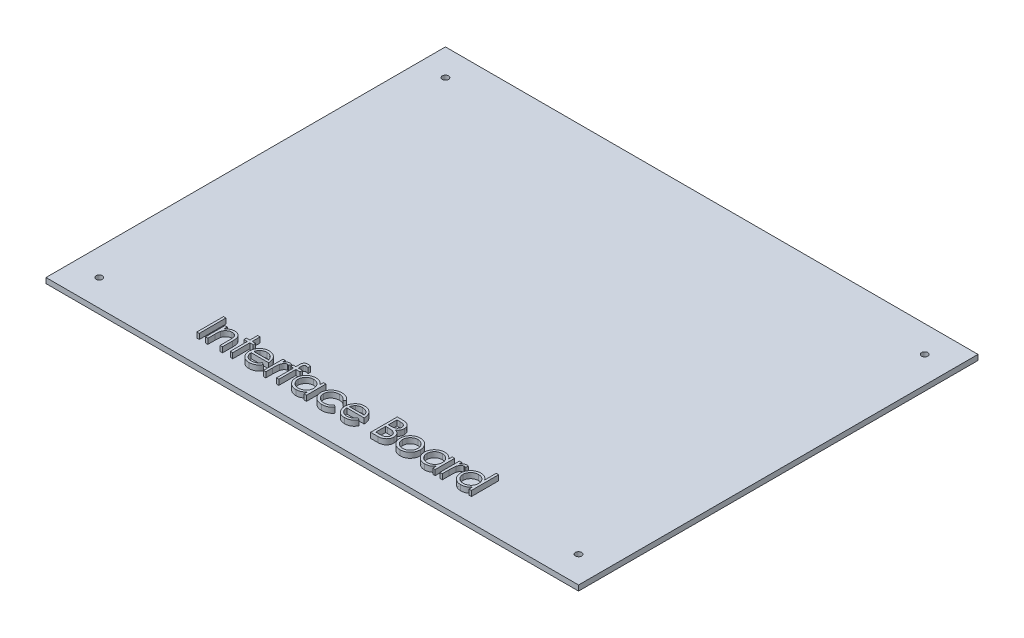
from build123d import *

# Parameters (mm, degrees)
SKETCH1_W             = 254
SKETCH1_H             = 190.5
BOSS_EXTRUDE1_DEPTH   = 2.54
F_3_0MM_DOWEL_HOLE1_D = 3
SKETCH5_W             = 1.13974359
SKETCH5_H             = 12.7
BOSS_EXTRUDE2_DEPTH   = 2.54


with BuildPart() as part:
    # Sketch1 → Boss-Extrude1 (new body)
    with BuildSketch(Plane(origin=(0, 0, 0), x_dir=(1, 0, 0), z_dir=(0, 1, 0))):
        Rectangle(SKETCH1_W, SKETCH1_H)
    extrude(amount=BOSS_EXTRUDE1_DEPTH)

    # Ø3.0mm Dowel Hole1 (through all)
    with Locations(Plane(origin=(0, 2.54, 0), x_dir=(1, 0, 0), z_dir=(0, 1, 0))):
        with Locations((-114.3, 82.55), (114.3, 82.55), (114.3, -82.55), (-114.3, -82.55)):
            Hole(F_3_0MM_DOWEL_HOLE1_D / 2)

    # Sketch5 → Boss-Extrude2 (add)
    # profile 1 of 14: a face of its own
    with BuildSketch(Plane(origin=(0, 2.54, 0), x_dir=(1, 0, 0), z_dir=(0, 1, 0))):
        with Locations((-65.411388588, -77.958886112)):
            Rectangle(SKETCH5_W, SKETCH5_H)
    # profile 2 of 14: a face of its own
    with BuildSketch(Plane(origin=(0, 2.54, 0), x_dir=(1, 0, 0), z_dir=(0, 1, 0))):
        with BuildLine():
            Line((-61.910747563, -75.028116882), (-60.771003973, -75.028116882))
            Line((-60.771003973, -75.028116882), (-60.771003973, -76.702115279))
            add(Edge.make_bspline(
                [(-60.771003973, -76.702115279), (-60.649310268, -76.55028597), (-60.413159389, -76.2556559), (-60.019879094, -75.868412672), (-59.60424837, -75.549297142), (-59.168812528, -75.294920518), (-58.712980463, -75.10316276), (-58.239530741, -74.964674953), (-57.745628807, -74.881635718), (-57.409752136, -74.870785454), (-57.239834101, -74.865296369)],
                knots=[0, 0, 0, 0, 1.12780773, 2.188550248, 3.19190651, 4.159438251, 5.104880172, 6.052711206, 7.014878035, 8, 8, 8, 8], degree=3))
            add(Edge.make_bspline(
                [(-57.239834101, -74.865296369), (-57.068091514, -74.871628935), (-56.731949846, -74.884023295), (-56.242535166, -74.982055288), (-55.785431709, -75.149496643), (-55.362269321, -75.378866155), (-54.980807718, -75.664095359), (-54.6458004, -75.996391881), (-54.368710902, -76.378611383), (-54.182937613, -76.733206836), (-54.060561692, -77.047763318), (-53.983518638, -77.317172954), (-53.918091934, -77.617321674), (-53.86137102, -77.947302468), (-53.822991214, -78.30942733), (-53.792720613, -78.702211813), (-53.771026494, -79.125528686), (-53.770165772, -79.418305877), (-53.769721922, -79.569282747)],
                knots=[0, 0, 0, 0, 1.235846778, 2.418850247, 3.575807741, 4.728682307, 5.871620074, 6.994088408, 8.11269785, 9.256955736, 9.865816715, 10.540099792, 11.271859618, 12.076849838, 12.949306005, 13.892391288, 14.913166135, 16, 16, 16, 16], degree=3))
            Line((-53.769721922, -79.569282747), (-53.769721922, -84.308886112))
            Line((-53.769721922, -84.308886112), (-54.909465511, -84.308886112))
            Line((-54.909465511, -84.308886112), (-54.909465511, -79.943261112))
            add(Edge.make_bspline(
                [(-54.909465511, -79.943261112), (-54.91016658, -79.816905384), (-54.911507606, -79.575208379), (-54.915737239, -79.229155066), (-54.925932823, -78.915332339), (-54.940259558, -78.634490463), (-54.961229183, -78.386899113), (-54.983082731, -78.172054023), (-55.009807075, -77.990227969), (-55.033621075, -77.880771813), (-55.044301249, -77.831682587)],
                knots=[0, 0, 0, 0, 1.430800155, 2.736877192, 3.918605307, 4.986035426, 5.920637409, 6.731861385, 7.431261377, 8, 8, 8, 8], degree=3))
            add(Edge.make_bspline(
                [(-55.044301249, -77.831682587), (-55.082856749, -77.687587716), (-55.157064157, -77.410249671), (-55.340430325, -77.034059877), (-55.571984638, -76.714026453), (-55.854642548, -76.452128063), (-56.185673766, -76.24830817), (-56.564159684, -76.106888391), (-56.986447894, -76.018437357), (-57.283462368, -76.009630335), (-57.438271601, -76.005039959)],
                knots=[0, 0, 0, 0, 1.084156227, 2.086665306, 3.027808233, 3.945421172, 4.874247719, 5.839848303, 6.874090471, 8, 8, 8, 8], degree=3))
            add(Edge.make_bspline(
                [(-57.438271601, -76.005039959), (-57.529957196, -76.006767175), (-57.711400619, -76.010185293), (-57.980459089, -76.044480003), (-58.241441088, -76.100572113), (-58.496965847, -76.176295455), (-58.741922698, -76.280298546), (-58.984181698, -76.39833369), (-59.214620528, -76.545465773), (-59.438152854, -76.709443171), (-59.646116471, -76.891159151), (-59.839622156, -77.082909231), (-60.012117258, -77.287109279), (-60.168395022, -77.500469089), (-60.303299007, -77.725918901), (-60.421057355, -77.96128367), (-60.52097259, -78.206873182), (-60.570621217, -78.377325547), (-60.595463107, -78.462612074)],
                knots=[0, 0, 0, 0, 1.023777757, 2.026029729, 3.023749952, 4.003683103, 4.997618607, 5.993177895, 7.010360494, 8.046726602, 9.087585522, 10.09234134, 11.086953743, 12.070360549, 13.043493632, 14.017870808, 15.008233677, 16, 16, 16, 16], degree=3))
            add(Edge.make_bspline(
                [(-60.595463107, -78.462612074), (-60.609758404, -78.525223811), (-60.640878516, -78.661526286), (-60.674490626, -78.885207465), (-60.704998114, -79.143960803), (-60.730532221, -79.437484354), (-60.746154732, -79.766805786), (-60.763188686, -80.130518683), (-60.769390136, -80.530073341), (-60.770450963, -80.808245769), (-60.771003973, -80.953257106)],
                knots=[0, 0, 0, 0, 0.615963638, 1.340920617, 2.168419149, 3.115676021, 4.16674242, 5.331190069, 6.6087489, 8, 8, 8, 8], degree=3))
            Line((-60.771003973, -80.953257106), (-60.771003973, -84.308886112))
            Line((-60.771003973, -84.308886112), (-61.910747563, -84.308886112))
            Line((-61.910747563, -84.308886112), (-61.910747563, -75.028116882))
        make_face()
    # profile 3 of 14: a face of its own
    with BuildSketch(Plane(origin=(0, 2.54, 0), x_dir=(1, 0, 0), z_dir=(0, 1, 0))):
        Polygon((-50.024850127, -71.283245087), (-48.885106537, -71.283245087), (-48.885106537, -75.028116882), (-47.256901409, -75.028116882), (-47.256901409, -76.167860471), (-48.885106537, -76.167860471), (-48.885106537, -84.308886112), (-50.024850127, -84.308886112), (-50.024850127, -76.167860471), (-51.653055255, -76.167860471), (-51.653055255, -75.028116882), (-50.024850127, -75.028116882), align=None)
    # profile 4 of 14: a face of its own
    with BuildSketch(Plane(origin=(0, 2.54, 0), x_dir=(1, 0, 0), z_dir=(0, 1, 0))):
        with BuildLine():
            Line((-37.68610814, -81.378116882), (-36.673568075, -81.909827619))
            add(Edge.make_bspline(
                [(-36.673568075, -81.909827619), (-36.75425515, -82.052950564), (-36.911240243, -82.331411137), (-37.181208671, -82.713978173), (-37.464208478, -83.058139885), (-37.773014304, -83.354701774), (-38.098387139, -83.613242513), (-38.442131344, -83.839439763), (-38.806036482, -84.032184108), (-39.19011977, -84.194571852), (-39.597606712, -84.319429159), (-40.029484786, -84.407618761), (-40.486581355, -84.462131764), (-40.799894636, -84.468464132), (-40.96032689, -84.471706625)],
                knots=[0, 0, 0, 0, 1.120438281, 2.179929193, 3.190490725, 4.156257408, 5.095198341, 6.022838206, 6.959905092, 7.901321166, 8.864066838, 9.862729781, 10.905609505, 12, 12, 12, 12], degree=3))
            add(Edge.make_bspline(
                [(-40.96032689, -84.471706625), (-41.138642065, -84.467544018), (-41.486483315, -84.459423976), (-41.992813254, -84.389419891), (-42.469532858, -84.275220189), (-42.916615324, -84.115688082), (-43.332965784, -83.907308934), (-43.719411743, -83.653455957), (-44.077985451, -83.355433205), (-44.397387581, -83.010659252), (-44.68492967, -82.641699007), (-44.938660503, -82.257230512), (-45.150777467, -81.858221098), (-45.323325509, -81.447210911), (-45.462680305, -81.026790497), (-45.559805202, -80.5931346), (-45.615793144, -80.147416909), (-45.624372704, -79.845892291), (-45.628696281, -79.693942202)],
                knots=[0, 0, 0, 0, 1.145258523, 2.234067595, 3.276747158, 4.290159414, 5.277019952, 6.260822364, 7.254936242, 8.264827045, 9.274100331, 10.257902744, 11.220704747, 12.172965371, 13.118907548, 14.062713208, 15.023725156, 16, 16, 16, 16], degree=3))
            add(Edge.make_bspline(
                [(-45.628696281, -79.693942202), (-45.624853111, -79.551358103), (-45.617236455, -79.268775248), (-45.569227598, -78.850525987), (-45.484143792, -78.444022745), (-45.367389702, -78.048927748), (-45.216618037, -77.665902519), (-45.032169699, -77.294713945), (-44.813757357, -76.935757009), (-44.645127941, -76.709322781), (-44.560186665, -76.595264318)],
                knots=[0, 0, 0, 0, 1.024358464, 2.0301432, 3.019427413, 4.004406732, 4.986367066, 5.972626655, 6.978780325, 8, 8, 8, 8], degree=3))
            add(Edge.make_bspline(
                [(-44.560186665, -76.595264318), (-44.445133073, -76.457854417), (-44.218670496, -76.187387414), (-43.835651721, -75.832011204), (-43.420905294, -75.534309505), (-42.979628822, -75.287540754), (-42.506693616, -75.100039235), (-42.008457046, -74.960311722), (-41.479245919, -74.882014368), (-41.117458403, -74.870955086), (-40.932342114, -74.865296369)],
                knots=[0, 0, 0, 0, 1.030682036, 2.02871468, 2.997146059, 3.962720338, 4.930598197, 5.918074684, 6.934738563, 8, 8, 8, 8], degree=3))
            add(Edge.make_bspline(
                [(-40.932342114, -74.865296369), (-40.742032232, -74.870209632), (-40.368687625, -74.879848334), (-39.824285357, -74.969206744), (-39.309170757, -75.110911728), (-38.823549956, -75.311041196), (-38.367373718, -75.569248713), (-37.943607196, -75.88907768), (-37.545003136, -76.260709025), (-37.313106293, -76.546506957), (-37.195102531, -76.691938997)],
                knots=[0, 0, 0, 0, 1.056321875, 2.072262726, 3.055038591, 4.01806755, 4.982017516, 5.957941055, 6.960871419, 8, 8, 8, 8], degree=3))
            add(Edge.make_bspline(
                [(-37.195102531, -76.691938997), (-37.114813354, -76.801534849), (-36.954769431, -77.019997052), (-36.754301382, -77.376218107), (-36.580284549, -77.748910835), (-36.441190662, -78.144099628), (-36.328561615, -78.557102104), (-36.247075444, -78.990870767), (-36.199288542, -79.445276445), (-36.189895269, -79.754889946), (-36.185106537, -79.912732266)],
                knots=[0, 0, 0, 0, 0.94817472, 1.890038105, 2.849395472, 3.817997239, 4.812318967, 5.836947057, 6.897266129, 8, 8, 8, 8], degree=3))
            Line((-36.185106537, -79.912732266), (-44.488952691, -79.912732266))
            add(Edge.make_bspline(
                [(-44.488952691, -79.912732266), (-44.483366119, -80.035016808), (-44.472380351, -80.275484427), (-44.421162545, -80.62734984), (-44.340431281, -80.96253311), (-44.226969253, -81.278520148), (-44.0895667, -81.57943804), (-43.921252814, -81.863054574), (-43.72044929, -82.12807792), (-43.49647318, -82.376878676), (-43.247164577, -82.59844201), (-42.984881466, -82.796749883), (-42.705867673, -82.962958763), (-42.412323199, -83.097868649), (-42.104722721, -83.203482996), (-41.782969327, -83.275574802), (-41.447696162, -83.32386059), (-41.219147927, -83.329229661), (-41.102794838, -83.331963035)],
                knots=[0, 0, 0, 0, 1.094153842, 2.151609401, 3.174256925, 4.172055639, 5.149267565, 6.128595816, 7.11444997, 8.118368179, 9.117203808, 10.09244225, 11.054858984, 12.015122123, 12.976791628, 13.957293641, 14.960065497, 16, 16, 16, 16], degree=3))
            add(Edge.make_bspline(
                [(-41.102794838, -83.331963035), (-40.98903496, -83.329756658), (-40.763313538, -83.325378783), (-40.42715957, -83.282808706), (-40.096453285, -83.213973706), (-39.772563432, -83.120030028), (-39.462063505, -83.005451165), (-39.174515366, -82.867192224), (-38.910064298, -82.714248857), (-38.662897019, -82.539316608), (-38.423153701, -82.325201186), (-38.185328107, -82.058008713), (-37.930324251, -81.742005398), (-37.770704871, -81.504168267), (-37.68610814, -81.378116882)],
                knots=[0, 0, 0, 0, 0.99110716, 1.966546729, 2.947904876, 3.932708344, 4.903319531, 5.828989031, 6.710028674, 7.56322171, 8.463672341, 9.504779593, 10.677557249, 12, 12, 12, 12], degree=3))
        make_face()
        with BuildLine():
            add(Edge.make_bspline(
                [(-37.324850127, -78.772988676), (-37.36656645, -78.621811963), (-37.446856944, -78.330845454), (-37.614628895, -77.927925652), (-37.8035742, -77.569829554), (-38.027173054, -77.259297743), (-38.280515287, -76.983513567), (-38.573142092, -76.742508986), (-38.901295192, -76.526908521), (-39.263278359, -76.344926594), (-39.646607122, -76.190023393), (-40.04794959, -76.086155116), (-40.457462135, -76.015000491), (-40.734446545, -76.008374326), (-40.873828492, -76.005039959)],
                knots=[0, 0, 0, 0, 1.154881502, 2.222775134, 3.210006277, 4.132804581, 5.035138423, 5.962687519, 6.919655026, 7.923214229, 8.944639381, 9.960483929, 10.97369054, 12, 12, 12, 12], degree=3))
            add(Edge.make_bspline(
                [(-40.873828492, -76.005039959), (-40.987582169, -76.007259452), (-41.212449273, -76.011646925), (-41.54374172, -76.053267109), (-41.861893771, -76.12206426), (-42.169252957, -76.21627996), (-42.461791537, -76.341859746), (-42.745526838, -76.489118883), (-43.013244276, -76.668884058), (-43.180671263, -76.80589476), (-43.265254774, -76.875112074)],
                knots=[0, 0, 0, 0, 1.04873581, 2.073130211, 3.073294108, 4.04793562, 5.032784715, 6.005352987, 6.992311501, 8, 8, 8, 8], degree=3))
            add(Edge.make_bspline(
                [(-43.265254774, -76.875112074), (-43.32582754, -76.929882876), (-43.448412056, -77.040725632), (-43.612207662, -77.231694467), (-43.769036235, -77.437621564), (-43.911761203, -77.666385302), (-44.042671303, -77.9153807), (-44.165171791, -78.182507548), (-44.275431058, -78.469792906), (-44.337465514, -78.669990043), (-44.369381377, -78.772988676)],
                knots=[0, 0, 0, 0, 0.879870761, 1.780643979, 2.707998968, 3.669668524, 4.684282772, 5.740141944, 6.837334558, 8, 8, 8, 8], degree=3))
            Line((-44.369381377, -78.772988676), (-37.324850127, -78.772988676))
        make_face(mode=Mode.SUBTRACT)
    # profile 5 of 14: a face of its own
    with BuildSketch(Plane(origin=(0, 2.54, 0), x_dir=(1, 0, 0), z_dir=(0, 1, 0))):
        with BuildLine():
            Line((-34.231260383, -75.028116882), (-33.091516793, -75.028116882))
            Line((-33.091516793, -75.028116882), (-33.091516793, -76.394282747))
            add(Edge.make_bspline(
                [(-33.091516793, -76.394282747), (-33.007374726, -76.26708017), (-32.846453676, -76.02380623), (-32.578981046, -75.702063337), (-32.305011816, -75.435671597), (-32.023234422, -75.2233874), (-31.731576745, -75.064408369), (-31.436439806, -74.947956499), (-31.133180244, -74.879095955), (-30.92939269, -74.869902393), (-30.827294037, -74.865296369)],
                knots=[0, 0, 0, 0, 1.2804753, 2.448899062, 3.506932113, 4.484331642, 5.4025378, 6.288909075, 7.142734305, 8, 8, 8, 8], degree=3))
            add(Edge.make_bspline(
                [(-30.827294037, -74.865296369), (-30.748095652, -74.86961628), (-30.585139829, -74.878504777), (-30.338460146, -74.940955483), (-30.084302477, -75.040661451), (-29.920500101, -75.134424545), (-29.835106537, -75.183305183)],
                knots=[0, 0, 0, 0, 0.901110191, 1.854092781, 2.881294221, 4, 4, 4, 4], degree=3))
            Line((-29.835106537, -75.183305183), (-30.460947883, -76.170404542))
            add(Edge.make_bspline(
                [(-30.460947883, -76.170404542), (-30.515772046, -76.145947005), (-30.619838801, -76.099521917), (-30.772073942, -76.044578052), (-30.912431935, -76.012226015), (-31.001852847, -76.00732484), (-31.043540031, -76.005039959)],
                knots=[0, 0, 0, 0, 1.180555205, 2.24091978, 3.179933427, 4, 4, 4, 4], degree=3))
            add(Edge.make_bspline(
                [(-31.043540031, -76.005039959), (-31.135000835, -76.011136094), (-31.321554364, -76.023570444), (-31.595455262, -76.121319832), (-31.861237979, -76.279254275), (-32.072318011, -76.454409452), (-32.235757043, -76.62331146), (-32.352380147, -76.770807092), (-32.4593604, -76.936192412), (-32.561578057, -77.116640122), (-32.654710039, -77.315231277), (-32.741631267, -77.529981795), (-32.820221999, -77.761140405), (-32.865035742, -77.92218555), (-32.887991152, -78.004679382)],
                knots=[0, 0, 0, 0, 1.125678352, 2.296057538, 3.5422874, 4.923748041, 5.663163013, 6.437101912, 7.23742474, 8.08941207, 8.991984279, 9.93940061, 10.944477711, 12, 12, 12, 12], degree=3))
            add(Edge.make_bspline(
                [(-32.887991152, -78.004679382), (-32.90516298, -78.078256554), (-32.943197272, -78.241224401), (-32.980177995, -78.514631905), (-33.016715961, -78.837660609), (-33.042466547, -79.211209675), (-33.066335443, -79.634346257), (-33.079797741, -80.107714974), (-33.091057709, -80.631801706), (-33.091359123, -80.998194359), (-33.091516793, -81.189855664)],
                knots=[0, 0, 0, 0, 0.566838948, 1.255505196, 2.06880316, 3.007127437, 4.065329342, 5.249902469, 6.561414163, 8, 8, 8, 8], degree=3))
            Line((-33.091516793, -81.189855664), (-33.091516793, -84.308886112))
            Line((-33.091516793, -84.308886112), (-34.231260383, -84.308886112))
            Line((-34.231260383, -84.308886112), (-34.231260383, -75.028116882))
        make_face()
    # profile 6 of 14: a face of its own
    with BuildSketch(Plane(origin=(0, 2.54, 0), x_dir=(1, 0, 0), z_dir=(0, 1, 0))):
        with BuildLine():
            Line((-24.78767064, -71.359567202), (-24.78767064, -72.545104061))
            add(Edge.make_bspline(
                [(-24.78767064, -72.545104061), (-24.895579924, -72.501739467), (-25.100393989, -72.419432568), (-25.402437639, -72.329935212), (-25.680127978, -72.272111241), (-25.85848638, -72.263997957), (-25.942678652, -72.260168164)],
                knots=[0, 0, 0, 0, 1.16548392, 2.212112691, 3.15604595, 4, 4, 4, 4], degree=3))
            add(Edge.make_bspline(
                [(-25.942678652, -72.260168164), (-25.999552025, -72.262531598), (-26.109639904, -72.267106419), (-26.267857689, -72.290431876), (-26.410421393, -72.337976325), (-26.53707893, -72.399768272), (-26.642127743, -72.477253453), (-26.732066327, -72.55510541), (-26.797259164, -72.642863065), (-26.832655688, -72.724579982), (-26.854245691, -72.800239301), (-26.860741299, -72.877724782), (-26.876652273, -72.972880751), (-26.881089314, -73.0895891), (-26.89120348, -73.224218935), (-26.890308525, -73.379619388), (-26.898595903, -73.55334502), (-26.897355242, -73.676355583), (-26.896705095, -73.740817202)],
                knots=[0, 0, 0, 0, 1.311993654, 2.539582093, 3.670788641, 4.763509788, 5.772417512, 6.671800701, 7.496729179, 8.266799162, 8.712543678, 9.304149002, 10.05334463, 10.934920737, 11.99209668, 13.165090968, 14.514413552, 16, 16, 16, 16], degree=3))
            Line((-26.896705095, -73.740817202), (-26.896705095, -75.028116882))
            Line((-26.896705095, -75.028116882), (-24.950491152, -75.028116882))
            Line((-24.950491152, -75.028116882), (-24.950491152, -76.167860471))
            Line((-24.950491152, -76.167860471), (-26.899249165, -76.167860471))
            Line((-26.899249165, -76.167860471), (-26.904337306, -84.308886112))
            Line((-26.904337306, -84.308886112), (-28.044080896, -84.308886112))
            Line((-28.044080896, -84.308886112), (-28.044080896, -76.167860471))
            Line((-28.044080896, -76.167860471), (-29.346644999, -76.167860471))
            Line((-29.346644999, -76.167860471), (-29.346644999, -75.028116882))
            Line((-29.346644999, -75.028116882), (-28.044080896, -75.028116882))
            Line((-28.044080896, -75.028116882), (-28.044080896, -73.544923773))
            add(Edge.make_bspline(
                [(-28.044080896, -73.544923773), (-28.043989404, -73.462643812), (-28.043813884, -73.304797673), (-28.031520826, -73.077614847), (-28.021013498, -72.867798276), (-28.000085247, -72.676976666), (-27.975912772, -72.503363517), (-27.941310137, -72.349537921), (-27.908611733, -72.211355537), (-27.849289698, -72.054954467), (-27.760671932, -71.877698665), (-27.61723379, -71.690377659), (-27.445264877, -71.52235685), (-27.239857531, -71.380815883), (-27.008661161, -71.263194007), (-26.751463743, -71.178859283), (-26.471065169, -71.131178241), (-26.276982063, -71.124087252), (-26.17673314, -71.120424574)],
                knots=[0, 0, 0, 0, 1.116398763, 2.141702935, 3.087165306, 3.966655413, 4.746276475, 5.464069668, 6.106083417, 6.67047701, 7.730773247, 8.782666744, 9.856985883, 10.980834087, 12.154321827, 13.366232824, 14.639591414, 16, 16, 16, 16], degree=3))
            add(Edge.make_bspline(
                [(-26.17673314, -71.120424574), (-26.074854617, -71.123898498), (-25.860966064, -71.131191817), (-25.526424106, -71.176307324), (-25.165031028, -71.254216489), (-24.917069258, -71.323441956), (-24.78767064, -71.359567202)],
                knots=[0, 0, 0, 0, 0.864728408, 1.815451418, 2.859995356, 4, 4, 4, 4], degree=3))
        make_face()
    # profile 7 of 14: a face of its own
    with BuildSketch(Plane(origin=(0, 2.54, 0), x_dir=(1, 0, 0), z_dir=(0, 1, 0))):
        with BuildLine():
            Line((-13.715875768, -75.028116882), (-13.715875768, -84.308886112))
            Line((-13.715875768, -84.308886112), (-14.855619357, -84.308886112))
            Line((-14.855619357, -84.308886112), (-14.855619357, -82.703577619))
            add(Edge.make_bspline(
                [(-14.855619357, -82.703577619), (-14.984138969, -82.848864145), (-15.234946608, -83.132392629), (-15.65383295, -83.502805084), (-16.097854624, -83.80897785), (-16.564856561, -84.056264687), (-17.054417044, -84.24201872), (-17.565450846, -84.374048498), (-18.098166428, -84.4589347), (-18.461939258, -84.467411122), (-18.646284422, -84.471706625)],
                knots=[0, 0, 0, 0, 1.074387032, 2.096679803, 3.090159297, 4.057316773, 5.018401886, 5.985159533, 6.978961417, 8, 8, 8, 8], degree=3))
            add(Edge.make_bspline(
                [(-18.646284422, -84.471706625), (-18.810179568, -84.467256646), (-19.133388055, -84.458481089), (-19.60883642, -84.390400731), (-20.066371154, -84.281069618), (-20.506424603, -84.129029247), (-20.926149245, -83.927350266), (-21.329138739, -83.685900595), (-21.713305364, -83.398369583), (-22.07279352, -83.069664451), (-22.40383535, -82.712631212), (-22.694343396, -82.331828799), (-22.936561715, -81.928903868), (-23.139108865, -81.508957852), (-23.295124172, -81.068758001), (-23.403885645, -80.609826563), (-23.471886694, -80.132706165), (-23.480658623, -79.80780561), (-23.485106537, -79.643060792)],
                knots=[0, 0, 0, 0, 1.033919861, 2.038935746, 3.024066025, 3.998881131, 4.97069526, 5.957263378, 6.95902576, 7.993208707, 9.027059324, 10.027763471, 11.009749337, 11.988697705, 12.965288445, 13.950418724, 14.960734635, 16, 16, 16, 16], degree=3))
            add(Edge.make_bspline(
                [(-23.485106537, -79.643060792), (-23.480560041, -79.481721067), (-23.471571863, -79.162761136), (-23.404613037, -78.693664146), (-23.292014805, -78.241840743), (-23.13399833, -77.808745549), (-22.931371807, -77.39385451), (-22.684889892, -76.996874191), (-22.394534782, -76.616710948), (-22.059790334, -76.262303925), (-21.697169882, -75.934931982), (-21.309243915, -75.65041916), (-20.905662295, -75.404703737), (-20.480165085, -75.210018266), (-20.039050162, -75.05250523), (-19.578390516, -74.94352846), (-19.100102788, -74.879312465), (-18.775380145, -74.870013293), (-18.610667434, -74.865296369)],
                knots=[0, 0, 0, 0, 1.020392517, 2.01726096, 2.990465484, 3.961182959, 4.928053699, 5.906110375, 6.912531644, 7.948652711, 8.985773172, 9.998621852, 10.987621588, 11.969261332, 12.953316658, 13.946091881, 14.958173133, 16, 16, 16, 16], degree=3))
            add(Edge.make_bspline(
                [(-18.610667434, -74.865296369), (-18.421256517, -74.870513353), (-18.049830648, -74.880743613), (-17.506531872, -74.965879795), (-16.992564766, -75.109710804), (-16.503961832, -75.305354297), (-16.042477628, -75.565336828), (-15.612481085, -75.893286972), (-15.209472045, -76.287136422), (-14.975863558, -76.589652035), (-14.855619357, -76.745364478)],
                knots=[0, 0, 0, 0, 1.038897134, 2.037228247, 3.008116434, 3.962042015, 4.918381754, 5.904844433, 6.921570401, 8, 8, 8, 8], degree=3))
            Line((-14.855619357, -76.745364478), (-14.855619357, -75.028116882))
            Line((-14.855619357, -75.028116882), (-13.715875768, -75.028116882))
        make_face()
        with BuildLine():
            add(Edge.make_bspline(
                [(-18.595403011, -76.005039959), (-18.762006466, -76.01096773), (-19.090855186, -76.022668207), (-19.57361485, -76.114012033), (-20.035580667, -76.265993275), (-20.474442137, -76.473844745), (-20.883266808, -76.735206161), (-21.248640986, -77.051332323), (-21.573553073, -77.41359806), (-21.846814489, -77.820368575), (-22.069574292, -78.256443362), (-22.226208951, -78.712280609), (-22.329511649, -79.179658671), (-22.340065423, -79.496660416), (-22.345362947, -79.655781144)],
                knots=[0, 0, 0, 0, 1.031046209, 2.035121221, 3.029706178, 4.034933723, 5.034054252, 6.02443088, 7.017295772, 8.038157696, 9.050218397, 10.03989886, 11.016116709, 12, 12, 12, 12], degree=3))
            add(Edge.make_bspline(
                [(-22.345362947, -79.655781144), (-22.338596049, -79.813950962), (-22.325088775, -80.129670625), (-22.22802197, -80.59768586), (-22.065172144, -81.053630527), (-21.842950945, -81.493634704), (-21.564688049, -81.902154154), (-21.242149224, -82.271325456), (-20.872215346, -82.588787676), (-20.462449821, -82.854535443), (-20.024815185, -83.069210876), (-19.564589205, -83.218583339), (-19.090423318, -83.315022715), (-18.768016278, -83.326287531), (-18.605579293, -83.331963035)],
                knots=[0, 0, 0, 0, 0.979072187, 1.954306742, 2.945804271, 3.96968567, 4.997920485, 5.998718438, 6.996577872, 8.005894225, 9.015743152, 10.005417472, 10.995077863, 12, 12, 12, 12], degree=3))
            add(Edge.make_bspline(
                [(-18.605579293, -83.331963035), (-18.440673412, -83.325939738), (-18.112691969, -83.313959996), (-17.628500087, -83.222225119), (-17.158618364, -83.070664051), (-16.709447564, -82.860572934), (-16.291014746, -82.600196242), (-15.915465304, -82.295370512), (-15.597907362, -81.94084753), (-15.328694178, -81.5512244), (-15.117600523, -81.124098013), (-14.963835966, -80.669313949), (-14.872926079, -80.186856378), (-14.861468031, -79.857150128), (-14.855619357, -79.688854061)],
                knots=[0, 0, 0, 0, 1.01762866, 2.023962475, 3.030623092, 4.058876274, 5.077231937, 6.066672613, 7.034107872, 8.005628644, 8.981990164, 9.965428785, 10.961468474, 12, 12, 12, 12], degree=3))
            add(Edge.make_bspline(
                [(-14.855619357, -79.688854061), (-14.859101539, -79.560628219), (-14.865955575, -79.308239184), (-14.918317927, -78.937662191), (-15.001611517, -78.583028385), (-15.118981905, -78.243964914), (-15.273164566, -77.922346429), (-15.459120745, -77.615863642), (-15.68012052, -77.326110561), (-15.932606303, -77.057077132), (-16.208977181, -76.811689683), (-16.501420228, -76.592653724), (-16.813400253, -76.41271732), (-17.139670644, -76.263796135), (-17.480797486, -76.145290077), (-17.839556592, -76.066231874), (-18.212134631, -76.01194728), (-18.466301746, -76.007366641), (-18.595403011, -76.005039959)],
                knots=[0, 0, 0, 0, 1.050140795, 2.067009409, 3.05949893, 4.030605086, 5.00011959, 5.97591094, 6.962425594, 7.979863591, 8.993523472, 9.986985069, 10.967611495, 11.937549037, 12.921786183, 13.919465291, 14.943216303, 16, 16, 16, 16], degree=3))
        make_face(mode=Mode.SUBTRACT)
    # profile 8 of 14: a face of its own
    with BuildSketch(Plane(origin=(0, 2.54, 0), x_dir=(1, 0, 0), z_dir=(0, 1, 0))):
        with BuildLine():
            Line((-1.992798845, -77.040476657), (-2.946825287, -77.633245087))
            add(Edge.make_bspline(
                [(-2.946825287, -77.633245087), (-3.051436513, -77.503239201), (-3.25734595, -77.247344686), (-3.614902607, -76.917108642), (-3.995944025, -76.633473948), (-4.406981512, -76.402320337), (-4.847438558, -76.223716789), (-5.315578161, -76.0973329), (-5.811333565, -76.018577505), (-6.15120443, -76.009626411), (-6.325350928, -76.005039959)],
                knots=[0, 0, 0, 0, 1.026593902, 2.0206758, 2.988051866, 3.946915611, 4.916868779, 5.907761954, 6.927957743, 8, 8, 8, 8], degree=3))
            add(Edge.make_bspline(
                [(-6.325350928, -76.005039959), (-6.464539143, -76.008874786), (-6.738666548, -76.016427374), (-7.141097448, -76.063636879), (-7.524428272, -76.149423595), (-7.891061701, -76.262457066), (-8.238390077, -76.413950975), (-8.56732341, -76.598317805), (-8.880779331, -76.812585094), (-9.169674364, -77.060817644), (-9.433939618, -77.330778524), (-9.662898535, -77.620170504), (-9.862241121, -77.920325538), (-10.018654162, -78.238739003), (-10.146652638, -78.568126396), (-10.23085988, -78.914705244), (-10.286974632, -79.274035443), (-10.293394767, -79.519030561), (-10.296644999, -79.643060792)],
                knots=[0, 0, 0, 0, 1.112346261, 2.190735716, 3.231507886, 4.247384806, 5.251966152, 6.253067467, 7.256802811, 8.280671706, 9.291813951, 10.270744147, 11.225547591, 12.165006084, 13.100104208, 14.043489273, 15.009504848, 16, 16, 16, 16], degree=3))
            add(Edge.make_bspline(
                [(-10.296644999, -79.643060792), (-10.290188855, -79.805509072), (-10.277363558, -80.128216782), (-10.176846833, -80.604568752), (-10.012311412, -81.065120428), (-9.787130068, -81.506601954), (-9.502370181, -81.915157889), (-9.167915451, -82.281583566), (-8.783580492, -82.598778869), (-8.352751749, -82.861750603), (-7.88554508, -83.073156137), (-7.387015271, -83.223768459), (-6.861236068, -83.314672782), (-6.5012573, -83.326124347), (-6.317718716, -83.331963035)],
                knots=[0, 0, 0, 0, 0.966302908, 1.919585723, 2.883856336, 3.870342332, 4.860282998, 5.839159637, 6.814385684, 7.815993281, 8.834850808, 9.858348828, 10.908058873, 12, 12, 12, 12], degree=3))
            add(Edge.make_bspline(
                [(-6.317718716, -83.331963035), (-6.149515619, -83.327247717), (-5.818951897, -83.317980865), (-5.335744891, -83.239861484), (-4.875714929, -83.111977442), (-4.43887836, -82.933641683), (-4.026033415, -82.703127554), (-3.639847552, -82.418795706), (-3.272636347, -82.088825756), (-3.056747318, -81.833671974), (-2.946825287, -81.703757907)],
                knots=[0, 0, 0, 0, 1.039848629, 2.043578496, 3.018386758, 3.987534228, 4.954977003, 5.934852016, 6.948509513, 8, 8, 8, 8], degree=3))
            Line((-2.946825287, -81.703757907), (-1.992798845, -82.329599253))
            add(Edge.make_bspline(
                [(-1.992798845, -82.329599253), (-2.049359936, -82.412659891), (-2.162294384, -82.578505478), (-2.351080339, -82.812345558), (-2.554715157, -83.031227091), (-2.772404394, -83.234856678), (-3.001305601, -83.428107205), (-3.249238302, -83.601740061), (-3.508208035, -83.765514989), (-3.781254979, -83.912881697), (-4.065556083, -84.045347492), (-4.360711302, -84.159252597), (-4.665438051, -84.257115553), (-4.980094616, -84.334902497), (-5.305301333, -84.396990397), (-5.640217149, -84.438188114), (-5.984726717, -84.468941277), (-6.217579952, -84.470776851), (-6.33552721, -84.471706625)],
                knots=[0, 0, 0, 0, 0.954134338, 1.905101784, 2.851144739, 3.791306361, 4.734911809, 5.6936923, 6.663572882, 7.643865596, 8.638447847, 9.640600242, 10.646758161, 11.676244097, 12.717260333, 13.78922464, 14.880174919, 16, 16, 16, 16], degree=3))
            add(Edge.make_bspline(
                [(-6.33552721, -84.471706625), (-6.515543845, -84.468472553), (-6.868377756, -84.462133747), (-7.384805141, -84.392434422), (-7.878340448, -84.287359643), (-8.348815061, -84.136542666), (-8.796302225, -83.942396767), (-9.220384683, -83.705244534), (-9.619658235, -83.423116611), (-9.990174504, -83.101034562), (-10.33046718, -82.751818522), (-10.622662213, -82.374991677), (-10.876100767, -81.984408446), (-11.079618423, -81.571442452), (-11.241622985, -81.141582385), (-11.352311949, -80.691384658), (-11.423902711, -80.224560764), (-11.432188117, -79.906215735), (-11.436388588, -79.744823612)],
                knots=[0, 0, 0, 0, 1.1129367, 2.181364009, 3.217532258, 4.231199276, 5.232079859, 6.230262199, 7.231623845, 8.250719726, 9.263571943, 10.242672461, 11.195837495, 12.138959767, 13.085126421, 14.0317438, 15.002148558, 16, 16, 16, 16], degree=3))
            add(Edge.make_bspline(
                [(-11.436388588, -79.744823612), (-11.43478833, -79.635319007), (-11.431605151, -79.417496273), (-11.395094728, -79.09420846), (-11.34792884, -78.775226024), (-11.26800688, -78.464592299), (-11.175693731, -78.157595961), (-11.057853944, -77.857937279), (-10.919622083, -77.564223752), (-10.762679302, -77.27721199), (-10.586008713, -77.001623661), (-10.390496809, -76.741260364), (-10.183507361, -76.492994358), (-9.955356897, -76.265396712), (-9.715727296, -76.049365389), (-9.457839007, -75.850671624), (-9.183171203, -75.668731456), (-8.895848861, -75.500180629), (-8.596039194, -75.350104964), (-8.285554419, -75.220807216), (-7.966265427, -75.110307869), (-7.637661475, -75.022826933), (-7.301923647, -74.949466569), (-6.95640622, -74.903318955), (-6.602431014, -74.870711622), (-6.362742017, -74.867116462), (-6.241396601, -74.865296369)],
                knots=[0, 0, 0, 0, 0.990994727, 1.971252077, 2.943264845, 3.907940874, 4.872158414, 5.844625996, 6.82015047, 7.809835459, 8.804511986, 9.781214284, 10.756496977, 11.728388426, 12.696359165, 13.676225489, 14.672885716, 15.677705647, 16.690706858, 17.706033469, 18.721040654, 19.747369689, 20.783475414, 21.830280724, 22.901553713, 24, 24, 24, 24], degree=3))
            add(Edge.make_bspline(
                [(-6.241396601, -74.865296369), (-6.089431638, -74.868641516), (-5.786261303, -74.875315091), (-5.336533596, -74.931480486), (-4.893429892, -75.01615834), (-4.464724688, -75.141608322), (-4.055615907, -75.293513587), (-3.672672988, -75.464102579), (-3.324910325, -75.662202998), (-3.005858788, -75.878901698), (-2.714921682, -76.123325556), (-2.449112523, -76.398396516), (-2.202980539, -76.702682997), (-2.063437614, -76.926949508), (-1.992798845, -77.040476657)],
                knots=[0, 0, 0, 0, 1.095225653, 2.184976855, 3.262915854, 4.344593502, 5.400796181, 6.407717688, 7.363229445, 8.282371371, 9.184954523, 10.097238608, 11.036792983, 12, 12, 12, 12], degree=3))
        make_face()
    # profile 9 of 14: a face of its own
    with BuildSketch(Plane(origin=(0, 2.54, 0), x_dir=(1, 0, 0), z_dir=(0, 1, 0))):
        with BuildLine():
            Line((7.90363545, -81.378116882), (8.916175514, -81.909827619))
            add(Edge.make_bspline(
                [(8.916175514, -81.909827619), (8.83548844, -82.052950564), (8.678503346, -82.331411137), (8.408534918, -82.713978173), (8.125535112, -83.058139885), (7.816729285, -83.354701774), (7.49135645, -83.613242513), (7.147612246, -83.839439763), (6.783707107, -84.032184108), (6.39962382, -84.194571852), (5.992136877, -84.319429159), (5.560258804, -84.407618761), (5.103162235, -84.462131764), (4.789848953, -84.468464132), (4.6294167, -84.471706625)],
                knots=[0, 0, 0, 0, 1.120438281, 2.179929193, 3.190490725, 4.156257408, 5.095198341, 6.022838206, 6.959905092, 7.901321166, 8.864066838, 9.862729781, 10.905609505, 12, 12, 12, 12], degree=3))
            add(Edge.make_bspline(
                [(4.6294167, -84.471706625), (4.451101525, -84.467544018), (4.103260275, -84.459423976), (3.596930336, -84.389419891), (3.120210732, -84.275220189), (2.673128265, -84.115688082), (2.256777806, -83.907308934), (1.870331847, -83.653455957), (1.511758139, -83.355433205), (1.192356008, -83.010659252), (0.90481392, -82.641699007), (0.651083087, -82.257230512), (0.438966123, -81.858221098), (0.26641808, -81.447210911), (0.127063285, -81.026790497), (0.029938388, -80.5931346), (-0.026049555, -80.147416909), (-0.034629114, -79.845892291), (-0.038952691, -79.693942202)],
                knots=[0, 0, 0, 0, 1.145258523, 2.234067595, 3.276747158, 4.290159414, 5.277019952, 6.260822364, 7.254936242, 8.264827045, 9.274100331, 10.257902744, 11.220704747, 12.172965371, 13.118907548, 14.062713208, 15.023725156, 16, 16, 16, 16], degree=3))
            add(Edge.make_bspline(
                [(-0.038952691, -79.693942202), (-0.035109521, -79.551358103), (-0.027492865, -79.268775248), (0.020515992, -78.850525987), (0.105599798, -78.444022745), (0.222353888, -78.048927748), (0.373125552, -77.665902519), (0.557573891, -77.294713945), (0.775986233, -76.935757009), (0.944615649, -76.709322781), (1.029556925, -76.595264318)],
                knots=[0, 0, 0, 0, 1.024358464, 2.0301432, 3.019427413, 4.004406732, 4.986367066, 5.972626655, 6.978780325, 8, 8, 8, 8], degree=3))
            add(Edge.make_bspline(
                [(1.029556925, -76.595264318), (1.144610516, -76.457854417), (1.371073094, -76.187387414), (1.754091869, -75.832011204), (2.168838296, -75.534309505), (2.610114768, -75.287540754), (3.083049974, -75.100039235), (3.581286544, -74.960311722), (4.110497671, -74.882014368), (4.472285187, -74.870955086), (4.657401476, -74.865296369)],
                knots=[0, 0, 0, 0, 1.030682036, 2.02871468, 2.997146059, 3.962720338, 4.930598197, 5.918074684, 6.934738563, 8, 8, 8, 8], degree=3))
            add(Edge.make_bspline(
                [(4.657401476, -74.865296369), (4.847711358, -74.870209632), (5.221055965, -74.879848334), (5.765458232, -74.969206744), (6.280572832, -75.110911728), (6.766193634, -75.311041196), (7.222369871, -75.569248713), (7.646136394, -75.88907768), (8.044740454, -76.260709025), (8.276637297, -76.546506957), (8.394641059, -76.691938997)],
                knots=[0, 0, 0, 0, 1.056321875, 2.072262726, 3.055038591, 4.01806755, 4.982017516, 5.957941055, 6.960871419, 8, 8, 8, 8], degree=3))
            add(Edge.make_bspline(
                [(8.394641059, -76.691938997), (8.474930235, -76.801534849), (8.634974159, -77.019997052), (8.835442208, -77.376218107), (9.009459041, -77.748910835), (9.148552928, -78.144099628), (9.261181975, -78.557102104), (9.342668146, -78.990870767), (9.390455048, -79.445276445), (9.399848321, -79.754889946), (9.404637053, -79.912732266)],
                knots=[0, 0, 0, 0, 0.94817472, 1.890038105, 2.849395472, 3.817997239, 4.812318967, 5.836947057, 6.897266129, 8, 8, 8, 8], degree=3))
            Line((9.404637053, -79.912732266), (1.100790899, -79.912732266))
            add(Edge.make_bspline(
                [(1.100790899, -79.912732266), (1.106377471, -80.035016808), (1.117363239, -80.275484427), (1.168581044, -80.62734984), (1.249312309, -80.96253311), (1.362774336, -81.278520148), (1.500176889, -81.57943804), (1.668490776, -81.863054574), (1.8692943, -82.12807792), (2.093270409, -82.376878676), (2.342579012, -82.59844201), (2.604862124, -82.796749883), (2.883875917, -82.962958763), (3.177420391, -83.097868649), (3.485020869, -83.203482996), (3.806774262, -83.275574802), (4.142047427, -83.32386059), (4.370595662, -83.329229661), (4.486948751, -83.331963035)],
                knots=[0, 0, 0, 0, 1.094153842, 2.151609401, 3.174256925, 4.172055639, 5.149267565, 6.128595816, 7.11444997, 8.118368179, 9.117203808, 10.09244225, 11.054858984, 12.015122123, 12.976791628, 13.957293641, 14.960065497, 16, 16, 16, 16], degree=3))
            add(Edge.make_bspline(
                [(4.486948751, -83.331963035), (4.60070863, -83.329756658), (4.826430051, -83.325378783), (5.162584019, -83.282808706), (5.493290305, -83.213973706), (5.817180158, -83.120030028), (6.127680085, -83.005451165), (6.415228223, -82.867192224), (6.679679292, -82.714248857), (6.92684657, -82.539316608), (7.166589889, -82.325201186), (7.404415483, -82.058008713), (7.659419339, -81.742005398), (7.819038719, -81.504168267), (7.90363545, -81.378116882)],
                knots=[0, 0, 0, 0, 0.99110716, 1.966546729, 2.947904876, 3.932708344, 4.903319531, 5.828989031, 6.710028674, 7.56322171, 8.463672341, 9.504779593, 10.677557249, 12, 12, 12, 12], degree=3))
        make_face()
        with BuildLine():
            add(Edge.make_bspline(
                [(8.264893463, -78.772988676), (8.22317714, -78.621811963), (8.142886646, -78.330845454), (7.975114695, -77.927925652), (7.78616939, -77.569829554), (7.562570536, -77.259297743), (7.309228303, -76.983513567), (7.016601497, -76.742508986), (6.688448398, -76.526908521), (6.326465231, -76.344926594), (5.943136468, -76.190023393), (5.541794, -76.086155116), (5.132281455, -76.015000491), (4.855297045, -76.008374326), (4.715915098, -76.005039959)],
                knots=[0, 0, 0, 0, 1.154881502, 2.222775134, 3.210006277, 4.132804581, 5.035138423, 5.962687519, 6.919655026, 7.923214229, 8.944639381, 9.960483929, 10.97369054, 12, 12, 12, 12], degree=3))
            add(Edge.make_bspline(
                [(4.715915098, -76.005039959), (4.602161421, -76.007259452), (4.377294317, -76.011646925), (4.04600187, -76.053267109), (3.727849819, -76.12206426), (3.420490633, -76.21627996), (3.127952053, -76.341859746), (2.844216751, -76.489118883), (2.576499314, -76.668884058), (2.409072327, -76.80589476), (2.324488816, -76.875112074)],
                knots=[0, 0, 0, 0, 1.04873581, 2.073130211, 3.073294108, 4.04793562, 5.032784715, 6.005352987, 6.992311501, 8, 8, 8, 8], degree=3))
            add(Edge.make_bspline(
                [(2.324488816, -76.875112074), (2.26391605, -76.929882876), (2.141331534, -77.040725632), (1.977535927, -77.231694467), (1.820707355, -77.437621564), (1.677982387, -77.666385302), (1.547072287, -77.9153807), (1.424571798, -78.182507548), (1.314312532, -78.469792906), (1.252278075, -78.669990043), (1.220362213, -78.772988676)],
                knots=[0, 0, 0, 0, 0.879870761, 1.780643979, 2.707998968, 3.669668524, 4.684282772, 5.740141944, 6.837334558, 8, 8, 8, 8], degree=3))
            Line((1.220362213, -78.772988676), (8.264893463, -78.772988676))
        make_face(mode=Mode.SUBTRACT)
    # profile 10 of 14: a face of its own
    with BuildSketch(Plane(origin=(0, 2.54, 0), x_dir=(1, 0, 0), z_dir=(0, 1, 0))):
        with BuildLine():
            Line((16.894380643, -71.608886112), (19.372305322, -71.608886112))
            add(Edge.make_bspline(
                [(19.372305322, -71.608886112), (19.493602943, -71.609523835), (19.72870792, -71.610759901), (20.070589895, -71.62993012), (20.390807008, -71.65606915), (20.689452125, -71.697544058), (20.966387245, -71.747588506), (21.222446957, -71.808192239), (21.456817011, -71.880860237), (21.736626083, -71.996416743), (22.055652481, -72.16813224), (22.401086649, -72.421873034), (22.696467746, -72.732233685), (22.951143811, -73.082327892), (23.15362216, -73.467449121), (23.300105038, -73.878418178), (23.392843615, -74.309934213), (23.402381076, -74.606182315), (23.407201155, -74.755901337)],
                knots=[0, 0, 0, 0, 1.001505555, 1.941167018, 2.826882275, 3.653841531, 4.429895133, 5.150066043, 5.825578002, 6.45369114, 7.647487171, 8.808567382, 9.977351308, 11.170798116, 12.373658725, 13.556498008, 14.765093433, 16, 16, 16, 16], degree=3))
            add(Edge.make_bspline(
                [(23.407201155, -74.755901337), (23.403234334, -74.896154896), (23.395439156, -75.171766366), (23.320898287, -75.574879277), (23.204201004, -75.958605128), (23.041984814, -76.321543498), (22.831157571, -76.655494037), (22.581300243, -76.963150688), (22.279850131, -77.231487381), (22.053996089, -77.381503056), (21.939272469, -77.457704221)],
                knots=[0, 0, 0, 0, 1.044552857, 2.05264487, 3.044412934, 4.028983338, 5.005914585, 5.980388656, 6.974128949, 8, 8, 8, 8], degree=3))
            add(Edge.make_bspline(
                [(21.939272469, -77.457704221), (22.083546021, -77.51309436), (22.359577064, -77.619069417), (22.739437738, -77.806432387), (23.066716176, -78.010220616), (23.343928677, -78.232767615), (23.581011025, -78.472648157), (23.788031698, -78.733379572), (23.964675542, -79.018363064), (24.116033864, -79.324627321), (24.23413935, -79.649045078), (24.322589061, -79.988573323), (24.373270947, -80.341994566), (24.380483246, -80.582515799), (24.384124232, -80.703938196)],
                knots=[0, 0, 0, 0, 1.27268992, 2.434971085, 3.483601985, 4.442670788, 5.356604649, 6.2567628, 7.179492994, 8.113709626, 9.066344395, 10.018646069, 10.999752585, 12, 12, 12, 12], degree=3))
            add(Edge.make_bspline(
                [(24.384124232, -80.703938196), (24.380579677, -80.827915132), (24.373605664, -81.071843227), (24.322152624, -81.430183286), (24.235033864, -81.772629521), (24.115032847, -82.101396898), (23.958415306, -82.415849386), (23.767813835, -82.71634323), (23.540550733, -82.999859229), (23.286322608, -83.269547805), (22.998714252, -83.512037205), (22.688414227, -83.727994197), (22.351514723, -83.90559848), (21.993548916, -84.054790901), (21.610501255, -84.168754164), (21.204091794, -84.248483218), (20.774671042, -84.302204352), (20.479995659, -84.306621067), (20.328875835, -84.308886112)],
                knots=[0, 0, 0, 0, 0.978564426, 1.925352924, 2.850884081, 3.763762016, 4.682927383, 5.618979971, 6.567305752, 7.547517671, 8.540179244, 9.531824382, 10.526200242, 11.540722885, 12.589160233, 13.674978461, 14.80764778, 16, 16, 16, 16], degree=3))
            Line((20.328875835, -84.308886112), (16.894380643, -84.308886112))
            Line((16.894380643, -84.308886112), (16.894380643, -71.608886112))
        make_face()
        with BuildLine():
            Line((18.034124232, -72.911450215), (18.034124232, -76.981963035))
            Line((18.034124232, -76.981963035), (18.799889457, -76.981963035))
            add(Edge.make_bspline(
                [(18.799889457, -76.981963035), (18.911826514, -76.980511886), (19.128111721, -76.97770797), (19.441329631, -76.969676066), (19.732068983, -76.947186022), (19.99982792, -76.924702443), (20.244184788, -76.888146082), (20.464598228, -76.844631807), (20.664527423, -76.79861098), (20.895085202, -76.720344556), (21.156607044, -76.604674135), (21.43540145, -76.425162044), (21.681180811, -76.211350819), (21.888724893, -75.964640758), (22.058583657, -75.692983455), (22.176561995, -75.400713346), (22.25656214, -75.095114581), (22.263788554, -74.885316921), (22.267457566, -74.778797971)],
                knots=[0, 0, 0, 0, 1.156816544, 2.235205308, 3.236616184, 4.169592532, 5.011045266, 5.787822928, 6.49130361, 7.128639758, 8.301311294, 9.436451833, 10.541879658, 11.654887649, 12.756523258, 13.837046038, 14.901820046, 16, 16, 16, 16], degree=3))
            add(Edge.make_bspline(
                [(22.267457566, -74.778797971), (22.265548283, -74.708310172), (22.261803017, -74.570040656), (22.231129605, -74.368475857), (22.178995835, -74.178905669), (22.112033114, -73.998732183), (22.018457015, -73.833589183), (21.908281019, -73.677766731), (21.775164372, -73.536571329), (21.62364498, -73.404602007), (21.449442263, -73.287600434), (21.252660147, -73.185126808), (21.03063629, -73.102610275), (20.787112502, -73.030343094), (20.51834027, -72.97958557), (20.227421176, -72.937300421), (19.911972339, -72.915773043), (19.693731538, -72.912923297), (19.580919104, -72.911450215)],
                knots=[0, 0, 0, 0, 0.91205012, 1.789085906, 2.630437955, 3.453916878, 4.269457761, 5.079663411, 5.91843418, 6.774407191, 7.675494373, 8.627863946, 9.638891023, 10.736472738, 11.911756761, 13.175263542, 14.539845004, 16, 16, 16, 16], degree=3))
            Line((19.580919104, -72.911450215), (18.034124232, -72.911450215))
        make_face(mode=Mode.SUBTRACT)
        with BuildLine():
            Line((18.034124232, -78.284527138), (18.034124232, -83.00632201))
            Line((18.034124232, -83.00632201), (19.657241219, -83.00632201))
            add(Edge.make_bspline(
                [(19.657241219, -83.00632201), (19.773424179, -83.004929555), (19.997351517, -83.002245782), (20.320661695, -82.993484398), (20.620320386, -82.973555283), (20.894960193, -82.9421832), (21.147546693, -82.908152828), (21.375049786, -82.862391894), (21.57931366, -82.809962809), (21.816166148, -82.728921669), (22.082878878, -82.603023046), (22.370301128, -82.413197139), (22.625847691, -82.187052565), (22.842855346, -81.925320391), (23.020702476, -81.640726719), (23.150080842, -81.339027878), (23.229876236, -81.025208964), (23.239536107, -80.811244036), (23.244380643, -80.703938196)],
                knots=[0, 0, 0, 0, 1.160039823, 2.235823828, 3.228722157, 4.157150951, 4.99529583, 5.772374946, 6.472645482, 7.099169577, 8.269452708, 9.405989375, 10.527446681, 11.663510218, 12.788923519, 13.866172445, 14.929861265, 16, 16, 16, 16], degree=3))
            add(Edge.make_bspline(
                [(23.244380643, -80.703938196), (23.243378778, -80.636833789), (23.24139121, -80.503707375), (23.211416978, -80.308069974), (23.167823794, -80.118564662), (23.111466877, -79.934676861), (23.029390525, -79.759731181), (22.93357249, -79.590267608), (22.821226832, -79.426062125), (22.64616943, -79.218463377), (22.391545372, -78.979278787), (22.029752216, -78.745099851), (21.618372735, -78.556240665), (21.320004403, -78.476051136), (21.165875034, -78.434627298)],
                knots=[0, 0, 0, 0, 0.723448775, 1.435228256, 2.130040452, 2.821711965, 3.505591119, 4.210454504, 4.921174351, 5.648778258, 7.137944449, 8.670945889, 10.280296675, 12, 12, 12, 12], degree=3))
            add(Edge.make_bspline(
                [(21.165875034, -78.434627298), (21.104083743, -78.422090279), (20.970107479, -78.394907436), (20.751639973, -78.36621377), (20.502226963, -78.340650267), (20.221292523, -78.321741209), (19.908481214, -78.302195751), (19.563124966, -78.294594543), (19.186634138, -78.285525799), (18.925404673, -78.284868541), (18.789713175, -78.284527138)],
                knots=[0, 0, 0, 0, 0.634451884, 1.375622551, 2.216452059, 3.157844607, 4.20941857, 5.370758133, 6.634282058, 8, 8, 8, 8], degree=3))
            Line((18.789713175, -78.284527138), (18.034124232, -78.284527138))
        make_face(mode=Mode.SUBTRACT)
    # profile 11 of 14: a face of its own
    with BuildSketch(Plane(origin=(0, 2.54, 0), x_dir=(1, 0, 0), z_dir=(0, 1, 0))):
        with BuildLine():
            add(Edge.make_bspline(
                [(31.146263655, -74.865296369), (31.320403417, -74.869004374), (31.661848931, -74.876274865), (32.161894689, -74.953980598), (32.639215611, -75.072806749), (33.095639794, -75.237077845), (33.52532178, -75.457266637), (33.934520294, -75.720008922), (34.322113441, -76.03127719), (34.554425575, -76.272062181), (34.672345386, -76.394282747)],
                knots=[0, 0, 0, 0, 1.054011418, 2.066658804, 3.057071809, 4.030435133, 4.997543892, 5.974964718, 6.972108034, 8, 8, 8, 8], degree=3))
            add(Edge.make_bspline(
                [(34.672345386, -76.394282747), (34.773879905, -76.511173495), (34.974983971, -76.742692834), (35.232851007, -77.118088916), (35.454997811, -77.506854424), (35.63302627, -77.914151866), (35.773397641, -78.336425673), (35.873058882, -78.775127256), (35.932338617, -79.229287773), (35.94033224, -79.537730271), (35.944380643, -79.693942202)],
                knots=[0, 0, 0, 0, 1.025258237, 2.030674902, 3.01204498, 3.988269485, 4.97094183, 5.956517959, 6.965070386, 8, 8, 8, 8], degree=3))
            add(Edge.make_bspline(
                [(35.944380643, -79.693942202), (35.94081979, -79.851059554), (35.933783379, -80.161530769), (35.867222257, -80.61880104), (35.763695174, -81.062193682), (35.615533932, -81.489852371), (35.425548793, -81.903084344), (35.19371687, -82.300084709), (34.918411288, -82.681636735), (34.606339642, -83.044500549), (34.26143712, -83.378932242), (33.887272811, -83.670409106), (33.491199602, -83.920132923), (33.067950863, -84.121287917), (32.621391697, -84.279891687), (32.150558907, -84.391288889), (31.656183937, -84.458641284), (31.31862802, -84.46729025), (31.146263655, -84.471706625)],
                knots=[0, 0, 0, 0, 0.998656419, 1.973391657, 2.932242238, 3.890759089, 4.846373663, 5.82037756, 6.809684879, 7.83454468, 8.860553229, 9.859544525, 10.845671541, 11.83227036, 12.833544569, 13.85385346, 14.904124723, 16, 16, 16, 16], degree=3))
            add(Edge.make_bspline(
                [(31.146263655, -84.471706625), (30.973054816, -84.467275428), (30.633816554, -84.458596703), (30.137696562, -84.391550563), (29.666019945, -84.279943026), (29.218876173, -84.120766695), (28.793807728, -83.920126494), (28.395439582, -83.671164077), (28.020971317, -83.3788458), (27.675995831, -83.044523971), (27.363943749, -82.681630701), (27.088633119, -82.300086275), (26.856802507, -81.903083936), (26.666817024, -81.48985248), (26.518655874, -81.062193653), (26.415128766, -80.618801048), (26.348567651, -80.161530767), (26.341531239, -79.851059554), (26.337970386, -79.693942202)],
                knots=[0, 0, 0, 0, 1.099876186, 2.154163076, 3.173186993, 4.173200201, 5.163417411, 6.152872554, 7.150605724, 8.17532212, 9.198891216, 10.186952605, 11.159729845, 12.11414092, 13.071450619, 14.029093627, 15.002601286, 16, 16, 16, 16], degree=3))
            add(Edge.make_bspline(
                [(26.337970386, -79.693942202), (26.342046398, -79.538579307), (26.350116201, -79.230987475), (26.409336334, -78.777680713), (26.50860881, -78.339721615), (26.649148449, -77.919077745), (26.828817856, -77.513565163), (27.047843101, -77.123839062), (27.308340539, -76.750140472), (27.508644763, -76.518920353), (27.610005643, -76.401914959)],
                knots=[0, 0, 0, 0, 1.031353054, 2.041901799, 3.029428768, 4.008703097, 4.981709435, 5.96992636, 6.972712378, 8, 8, 8, 8], degree=3))
            add(Edge.make_bspline(
                [(27.610005643, -76.401914959), (27.727747673, -76.278634465), (27.959308093, -76.036181681), (28.348830619, -75.725820808), (28.757022485, -75.457611054), (29.191452931, -75.241797358), (29.647502158, -75.071840451), (30.127269124, -74.953674153), (30.629011709, -74.876554837), (30.972128048, -74.869086592), (31.146263655, -74.865296369)],
                knots=[0, 0, 0, 0, 1.027980169, 2.021703884, 2.998553061, 3.971491411, 4.943284454, 5.930300938, 6.949603206, 8, 8, 8, 8], degree=3))
        make_face()
        with BuildLine():
            add(Edge.make_bspline(
                [(31.141175514, -76.005039959), (31.018030468, -76.008540048), (30.774919343, -76.015449874), (30.417071136, -76.068005756), (30.072574006, -76.151272414), (29.740774372, -76.269578561), (29.422791146, -76.422337423), (29.118319886, -76.609964901), (28.826465033, -76.829975915), (28.552935831, -77.08202618), (28.30190287, -77.357358532), (28.082454212, -77.650722577), (27.89585454, -77.957359891), (27.740405964, -78.277589343), (27.624628453, -78.614656102), (27.540543485, -78.964742963), (27.488037184, -79.328563189), (27.481192325, -79.575890313), (27.477713976, -79.701574414)],
                knots=[0, 0, 0, 0, 1.021534396, 2.016698045, 2.994645724, 3.958388632, 4.93408049, 5.916473867, 6.921342795, 7.962252576, 8.998418191, 10.008913653, 10.997312074, 11.973003931, 12.956656626, 13.948281152, 14.957379055, 16, 16, 16, 16], degree=3))
            add(Edge.make_bspline(
                [(27.477713976, -79.701574414), (27.48354445, -79.863960341), (27.495116851, -80.186266041), (27.589224709, -80.660923543), (27.746654925, -81.116606263), (27.959243054, -81.550642864), (28.225602762, -81.95222513), (28.539427261, -82.310261659), (28.89734846, -82.619364461), (29.29509976, -82.875834958), (29.724556857, -83.079614642), (30.179058365, -83.224028069), (30.653097454, -83.317905352), (30.977058965, -83.327236131), (31.141175514, -83.331963035)],
                knots=[0, 0, 0, 0, 1.016792936, 2.018143844, 3.017858371, 4.030088057, 5.03801393, 6.028138512, 7.003788237, 7.991172063, 8.984598303, 9.972568034, 10.972917682, 12, 12, 12, 12], degree=3))
            add(Edge.make_bspline(
                [(31.141175514, -83.331963035), (31.305282624, -83.32720859), (31.629225501, -83.317823446), (32.102605943, -83.224500872), (32.555865212, -83.078981875), (32.984876247, -82.876064142), (33.382446494, -82.618390522), (33.742941877, -82.312007097), (34.054086837, -81.951276836), (34.320183061, -81.550110946), (34.53625267, -81.117279154), (34.692946002, -80.66083944), (34.7872801, -80.18628746), (34.798821964, -79.863967517), (34.804637053, -79.701574414)],
                knots=[0, 0, 0, 0, 1.02726834, 2.027799167, 3.010890988, 4.004497153, 4.992059811, 5.971914811, 6.958719428, 7.966827853, 8.981595046, 9.981490638, 10.983022906, 12, 12, 12, 12], degree=3))
            add(Edge.make_bspline(
                [(34.804637053, -79.701574414), (34.801159902, -79.575889561), (34.794317399, -79.32856096), (34.741793957, -78.964751485), (34.657772427, -78.614624835), (34.54176113, -78.277704708), (34.386987994, -77.956530764), (34.196789916, -77.651622897), (33.978237338, -77.356342287), (33.724175214, -77.082916219), (33.450931529, -76.829877658), (33.15895839, -76.609879588), (32.854938611, -76.423162027), (32.537879182, -76.268271954), (32.206037008, -76.152348748), (31.862022568, -76.067524971), (31.505701172, -76.015671972), (31.263461215, -76.00860663), (31.141175514, -76.005039959)],
                knots=[0, 0, 0, 0, 1.042956736, 2.052379634, 3.044323526, 4.02829302, 5.004299113, 5.996692471, 7.007513377, 8.048758398, 9.090003419, 10.095195979, 11.07790575, 12.047570684, 13.018257071, 13.989683339, 14.985167495, 16, 16, 16, 16], degree=3))
        make_face(mode=Mode.SUBTRACT)
    # profile 12 of 14: a face of its own
    with BuildSketch(Plane(origin=(0, 2.54, 0), x_dir=(1, 0, 0), z_dir=(0, 1, 0))):
        with BuildLine():
            Line((47.667457566, -75.028116882), (47.667457566, -84.308886112))
            Line((47.667457566, -84.308886112), (46.527713976, -84.308886112))
            Line((46.527713976, -84.308886112), (46.527713976, -82.703577619))
            add(Edge.make_bspline(
                [(46.527713976, -82.703577619), (46.399194364, -82.848864145), (46.148386726, -83.132392629), (45.729500383, -83.502805084), (45.285478709, -83.80897785), (44.818476773, -84.056264687), (44.32891629, -84.24201872), (43.817882487, -84.374048498), (43.285166905, -84.4589347), (42.921394075, -84.467411122), (42.737048912, -84.471706625)],
                knots=[0, 0, 0, 0, 1.074387032, 2.096679803, 3.090159297, 4.057316773, 5.018401886, 5.985159533, 6.978961417, 8, 8, 8, 8], degree=3))
            add(Edge.make_bspline(
                [(42.737048912, -84.471706625), (42.573153765, -84.467256646), (42.249945279, -84.458481089), (41.774496913, -84.390400731), (41.316962179, -84.281069618), (40.87690873, -84.129029247), (40.457184088, -83.927350266), (40.054194594, -83.685900595), (39.670027969, -83.398369583), (39.310539813, -83.069664451), (38.979497983, -82.712631212), (38.688989937, -82.331828799), (38.446771619, -81.928903868), (38.244224469, -81.508957852), (38.088209162, -81.068758001), (37.979447689, -80.609826563), (37.911446639, -80.132706165), (37.902674711, -79.80780561), (37.898226796, -79.643060792)],
                knots=[0, 0, 0, 0, 1.033919861, 2.038935746, 3.024066025, 3.998881131, 4.97069526, 5.957263378, 6.95902576, 7.993208707, 9.027059324, 10.027763471, 11.009749337, 11.988697705, 12.965288445, 13.950418724, 14.960734635, 16, 16, 16, 16], degree=3))
            add(Edge.make_bspline(
                [(37.898226796, -79.643060792), (37.902773293, -79.481721067), (37.91176147, -79.162761136), (37.978720296, -78.693664146), (38.091318528, -78.241840743), (38.249335004, -77.808745549), (38.451961526, -77.39385451), (38.698443442, -76.996874191), (38.988798551, -76.616710948), (39.323543, -76.262303925), (39.686163451, -75.934931982), (40.074089418, -75.65041916), (40.477671039, -75.404703737), (40.903168248, -75.210018266), (41.344283171, -75.05250523), (41.804942817, -74.94352846), (42.283230546, -74.879312465), (42.607953188, -74.870013293), (42.772665899, -74.865296369)],
                knots=[0, 0, 0, 0, 1.020392517, 2.01726096, 2.990465484, 3.961182959, 4.928053699, 5.906110375, 6.912531644, 7.948652711, 8.985773172, 9.998621852, 10.987621588, 11.969261332, 12.953316658, 13.946091881, 14.958173133, 16, 16, 16, 16], degree=3))
            add(Edge.make_bspline(
                [(42.772665899, -74.865296369), (42.962076816, -74.870513353), (43.333502685, -74.880743613), (43.876801462, -74.965879795), (44.390768567, -75.109710804), (44.879371502, -75.305354297), (45.340855706, -75.565336828), (45.770852249, -75.893286972), (46.173861288, -76.287136422), (46.407469775, -76.589652035), (46.527713976, -76.745364478)],
                knots=[0, 0, 0, 0, 1.038897134, 2.037228247, 3.008116434, 3.962042015, 4.918381754, 5.904844433, 6.921570401, 8, 8, 8, 8], degree=3))
            Line((46.527713976, -76.745364478), (46.527713976, -75.028116882))
            Line((46.527713976, -75.028116882), (47.667457566, -75.028116882))
        make_face()
        with BuildLine():
            add(Edge.make_bspline(
                [(42.787930322, -76.005039959), (42.621326867, -76.01096773), (42.292478148, -76.022668207), (41.809718483, -76.114012033), (41.347752666, -76.265993275), (40.908891197, -76.473844745), (40.500066525, -76.735206161), (40.134692348, -77.051332323), (39.80978026, -77.41359806), (39.536518844, -77.820368575), (39.313759041, -78.256443362), (39.157124382, -78.712280609), (39.053821685, -79.179658671), (39.04326791, -79.496660416), (39.037970386, -79.655781144)],
                knots=[0, 0, 0, 0, 1.031046209, 2.035121221, 3.029706178, 4.034933723, 5.034054252, 6.02443088, 7.017295772, 8.038157696, 9.050218397, 10.03989886, 11.016116709, 12, 12, 12, 12], degree=3))
            add(Edge.make_bspline(
                [(39.037970386, -79.655781144), (39.044737285, -79.813950962), (39.058244558, -80.129670625), (39.155311363, -80.59768586), (39.31816119, -81.053630527), (39.540382389, -81.493634704), (39.818645284, -81.902154154), (40.141184109, -82.271325456), (40.511117987, -82.588787676), (40.920883513, -82.854535443), (41.358518148, -83.069210876), (41.818744128, -83.218583339), (42.292910015, -83.315022715), (42.615317055, -83.326287531), (42.77775404, -83.331963035)],
                knots=[0, 0, 0, 0, 0.979072187, 1.954306742, 2.945804271, 3.96968567, 4.997920485, 5.998718438, 6.996577872, 8.005894225, 9.015743152, 10.005417472, 10.995077863, 12, 12, 12, 12], degree=3))
            add(Edge.make_bspline(
                [(42.77775404, -83.331963035), (42.942659921, -83.325939738), (43.270641364, -83.313959996), (43.754833247, -83.222225119), (44.224714969, -83.070664051), (44.673885769, -82.860572934), (45.092318588, -82.600196242), (45.467868029, -82.295370512), (45.785425972, -81.94084753), (46.054639155, -81.5512244), (46.26573281, -81.124098013), (46.419497368, -80.669313949), (46.510407254, -80.186856378), (46.521865302, -79.857150128), (46.527713976, -79.688854061)],
                knots=[0, 0, 0, 0, 1.01762866, 2.023962475, 3.030623092, 4.058876274, 5.077231937, 6.066672613, 7.034107872, 8.005628644, 8.981990164, 9.965428785, 10.961468474, 12, 12, 12, 12], degree=3))
            add(Edge.make_bspline(
                [(46.527713976, -79.688854061), (46.524231794, -79.560628219), (46.517377759, -79.308239184), (46.465015406, -78.937662191), (46.381721816, -78.583028385), (46.264351428, -78.243964914), (46.110168767, -77.922346429), (45.924212588, -77.615863642), (45.703212813, -77.326110561), (45.45072703, -77.057077132), (45.174356153, -76.811689683), (44.881913105, -76.592653724), (44.569933081, -76.41271732), (44.243662689, -76.263796135), (43.902535847, -76.145290077), (43.543776741, -76.066231874), (43.171198703, -76.01194728), (42.917031587, -76.007366641), (42.787930322, -76.005039959)],
                knots=[0, 0, 0, 0, 1.050140795, 2.067009409, 3.05949893, 4.030605086, 5.00011959, 5.97591094, 6.962425594, 7.979863591, 8.993523472, 9.986985069, 10.967611495, 11.937549037, 12.921786183, 13.919465291, 14.943216303, 16, 16, 16, 16], degree=3))
        make_face(mode=Mode.SUBTRACT)
    # profile 13 of 14: a face of its own
    with BuildSketch(Plane(origin=(0, 2.54, 0), x_dir=(1, 0, 0), z_dir=(0, 1, 0))):
        with BuildLine():
            Line((49.946944745, -75.028116882), (51.086688335, -75.028116882))
            Line((51.086688335, -75.028116882), (51.086688335, -76.394282747))
            add(Edge.make_bspline(
                [(51.086688335, -76.394282747), (51.170830402, -76.26708017), (51.331751453, -76.02380623), (51.599224082, -75.702063337), (51.873193313, -75.435671597), (52.154970706, -75.2233874), (52.446628383, -75.064408369), (52.741765322, -74.947956499), (53.045024884, -74.879095955), (53.248812438, -74.869902393), (53.350911091, -74.865296369)],
                knots=[0, 0, 0, 0, 1.2804753, 2.448899062, 3.506932113, 4.484331642, 5.4025378, 6.288909075, 7.142734305, 8, 8, 8, 8], degree=3))
            add(Edge.make_bspline(
                [(53.350911091, -74.865296369), (53.430109476, -74.86961628), (53.593065299, -74.878504777), (53.839744982, -74.940955483), (54.093902651, -75.040661451), (54.257705027, -75.134424545), (54.343098591, -75.183305183)],
                knots=[0, 0, 0, 0, 0.901110191, 1.854092781, 2.881294221, 4, 4, 4, 4], degree=3))
            Line((54.343098591, -75.183305183), (53.717257245, -76.170404542))
            add(Edge.make_bspline(
                [(53.717257245, -76.170404542), (53.662433083, -76.145947005), (53.558366327, -76.099521917), (53.406131187, -76.044578052), (53.265773193, -76.012226015), (53.176352282, -76.00732484), (53.134665098, -76.005039959)],
                knots=[0, 0, 0, 0, 1.180555205, 2.24091978, 3.179933427, 4, 4, 4, 4], degree=3))
            add(Edge.make_bspline(
                [(53.134665098, -76.005039959), (53.043204293, -76.011136094), (52.856650764, -76.023570444), (52.582749866, -76.121319832), (52.316967149, -76.279254275), (52.105887117, -76.454409452), (51.942448085, -76.62331146), (51.825824981, -76.770807092), (51.718844728, -76.936192412), (51.616627071, -77.116640122), (51.523495089, -77.315231277), (51.436573861, -77.529981795), (51.35798313, -77.761140405), (51.313169386, -77.92218555), (51.290213976, -78.004679382)],
                knots=[0, 0, 0, 0, 1.125678352, 2.296057538, 3.5422874, 4.923748041, 5.663163013, 6.437101912, 7.23742474, 8.08941207, 8.991984279, 9.93940061, 10.944477711, 12, 12, 12, 12], degree=3))
            add(Edge.make_bspline(
                [(51.290213976, -78.004679382), (51.273042148, -78.078256554), (51.235007856, -78.241224401), (51.198027133, -78.514631905), (51.161489167, -78.837660609), (51.135738581, -79.211209675), (51.111869685, -79.634346257), (51.098407387, -80.107714974), (51.08714742, -80.631801706), (51.086846006, -80.998194359), (51.086688335, -81.189855664)],
                knots=[0, 0, 0, 0, 0.566838948, 1.255505196, 2.06880316, 3.007127437, 4.065329342, 5.249902469, 6.561414163, 8, 8, 8, 8], degree=3))
            Line((51.086688335, -81.189855664), (51.086688335, -84.308886112))
            Line((51.086688335, -84.308886112), (49.946944745, -84.308886112))
            Line((49.946944745, -84.308886112), (49.946944745, -75.028116882))
        make_face()
    # profile 14 of 14: a face of its own
    with BuildSketch(Plane(origin=(0, 2.54, 0), x_dir=(1, 0, 0), z_dir=(0, 1, 0))):
        with BuildLine():
            Line((64.926431925, -71.283245087), (64.926431925, -84.308886112))
            Line((64.926431925, -84.308886112), (63.786688335, -84.308886112))
            Line((63.786688335, -84.308886112), (63.786688335, -82.703577619))
            add(Edge.make_bspline(
                [(63.786688335, -82.703577619), (63.658168723, -82.848864145), (63.407361085, -83.132392629), (62.988474742, -83.502805084), (62.544453068, -83.80897785), (62.077451132, -84.056264687), (61.587890649, -84.24201872), (61.076856846, -84.374048498), (60.544141264, -84.4589347), (60.180368434, -84.467411122), (59.996023271, -84.471706625)],
                knots=[0, 0, 0, 0, 1.074387032, 2.096679803, 3.090159297, 4.057316773, 5.018401886, 5.985159533, 6.978961417, 8, 8, 8, 8], degree=3))
            add(Edge.make_bspline(
                [(59.996023271, -84.471706625), (59.832128124, -84.467256646), (59.508919638, -84.458481089), (59.033471272, -84.390400731), (58.575936538, -84.281069618), (58.135883089, -84.129029247), (57.716158447, -83.927350266), (57.313168953, -83.685900595), (56.929002328, -83.398369583), (56.569514172, -83.069664451), (56.238472342, -82.712631212), (55.947964296, -82.331828799), (55.705745978, -81.928903868), (55.503198828, -81.508957852), (55.347183521, -81.068758001), (55.238422048, -80.609826563), (55.170420998, -80.132706165), (55.16164907, -79.80780561), (55.157201155, -79.643060792)],
                knots=[0, 0, 0, 0, 1.033919861, 2.038935746, 3.024066025, 3.998881131, 4.97069526, 5.957263378, 6.95902576, 7.993208707, 9.027059324, 10.027763471, 11.009749337, 11.988697705, 12.965288445, 13.950418724, 14.960734635, 16, 16, 16, 16], degree=3))
            add(Edge.make_bspline(
                [(55.157201155, -79.643060792), (55.161747651, -79.481721067), (55.170735829, -79.162761136), (55.237694655, -78.693664146), (55.350292887, -78.241840743), (55.508309363, -77.808745549), (55.710935885, -77.39385451), (55.957417801, -76.996874191), (56.24777291, -76.616710948), (56.582517359, -76.262303925), (56.94513781, -75.934931982), (57.333063777, -75.65041916), (57.736645398, -75.404703737), (58.162142607, -75.210018266), (58.60325753, -75.05250523), (59.063917176, -74.94352846), (59.542204905, -74.879312465), (59.866927547, -74.870013293), (60.031640258, -74.865296369)],
                knots=[0, 0, 0, 0, 1.020392517, 2.01726096, 2.990465484, 3.961182959, 4.928053699, 5.906110375, 6.912531644, 7.948652711, 8.985773172, 9.998621852, 10.987621588, 11.969261332, 12.953316658, 13.946091881, 14.958173133, 16, 16, 16, 16], degree=3))
            add(Edge.make_bspline(
                [(60.031640258, -74.865296369), (60.221112674, -74.870982689), (60.593025972, -74.882144303), (61.136943464, -74.975421692), (61.651429937, -75.132041277), (62.139447349, -75.346458212), (62.598086296, -75.625135224), (63.030708677, -75.961690477), (63.42979102, -76.365648979), (63.665908776, -76.669039545), (63.786688335, -76.824230664)],
                knots=[0, 0, 0, 0, 1.031072012, 2.023879775, 2.993683497, 3.952812103, 4.918022106, 5.908088563, 6.929940113, 8, 8, 8, 8], degree=3))
            Line((63.786688335, -76.824230664), (63.786688335, -71.283245087))
            Line((63.786688335, -71.283245087), (64.926431925, -71.283245087))
        make_face()
        with BuildLine():
            add(Edge.make_bspline(
                [(60.046904681, -76.005039959), (59.880301226, -76.01096773), (59.551452507, -76.022668207), (59.068692842, -76.114012033), (58.606727025, -76.265993275), (58.167865556, -76.473844745), (57.759040884, -76.735206161), (57.393666707, -77.051332323), (57.068754619, -77.41359806), (56.795493203, -77.820368575), (56.5727334, -78.256443362), (56.416098741, -78.712280609), (56.312796044, -79.179658671), (56.302242269, -79.496660416), (56.296944745, -79.655781144)],
                knots=[0, 0, 0, 0, 1.031046209, 2.035121221, 3.029706178, 4.034933723, 5.034054252, 6.02443088, 7.017295772, 8.038157696, 9.050218397, 10.03989886, 11.016116709, 12, 12, 12, 12], degree=3))
            add(Edge.make_bspline(
                [(56.296944745, -79.655781144), (56.303711644, -79.813950962), (56.317218917, -80.129670625), (56.414285722, -80.59768586), (56.577135549, -81.053630527), (56.799356748, -81.493634704), (57.077619643, -81.902154154), (57.400158468, -82.271325456), (57.770092346, -82.588787676), (58.179857872, -82.854535443), (58.617492507, -83.069210876), (59.077718487, -83.218583339), (59.551884374, -83.315022715), (59.874291414, -83.326287531), (60.036728399, -83.331963035)],
                knots=[0, 0, 0, 0, 0.979072187, 1.954306742, 2.945804271, 3.96968567, 4.997920485, 5.998718438, 6.996577872, 8.005894225, 9.015743152, 10.005417472, 10.995077863, 12, 12, 12, 12], degree=3))
            add(Edge.make_bspline(
                [(60.036728399, -83.331963035), (60.20163428, -83.325939738), (60.529615723, -83.313959996), (61.013807606, -83.222225119), (61.483689328, -83.070664051), (61.932860128, -82.860572934), (62.351292947, -82.600196242), (62.726842388, -82.295370512), (63.044400331, -81.94084753), (63.313613514, -81.5512244), (63.524707169, -81.124098013), (63.678471727, -80.669313949), (63.769381613, -80.186856378), (63.780839661, -79.857150128), (63.786688335, -79.688854061)],
                knots=[0, 0, 0, 0, 1.01762866, 2.023962475, 3.030623092, 4.058876274, 5.077231937, 6.066672613, 7.034107872, 8.005628644, 8.981990164, 9.965428785, 10.961468474, 12, 12, 12, 12], degree=3))
            add(Edge.make_bspline(
                [(63.786688335, -79.688854061), (63.783206153, -79.560628219), (63.776352118, -79.308239184), (63.723989765, -78.937662191), (63.640696175, -78.583028385), (63.523325787, -78.243964914), (63.369143126, -77.922346429), (63.183186947, -77.615863642), (62.962187172, -77.326110561), (62.709701389, -77.057077132), (62.433330512, -76.811689683), (62.140887464, -76.592653724), (61.828907439, -76.41271732), (61.502637048, -76.263796135), (61.161510206, -76.145290077), (60.8027511, -76.066231874), (60.430173062, -76.01194728), (60.176005946, -76.007366641), (60.046904681, -76.005039959)],
                knots=[0, 0, 0, 0, 1.050140795, 2.067009409, 3.05949893, 4.030605086, 5.00011959, 5.97591094, 6.962425594, 7.979863591, 8.993523472, 9.986985069, 10.967611495, 11.937549037, 12.921786183, 13.919465291, 14.943216303, 16, 16, 16, 16], degree=3))
        make_face(mode=Mode.SUBTRACT)
    extrude(amount=BOSS_EXTRUDE2_DEPTH)


solid = part.part
